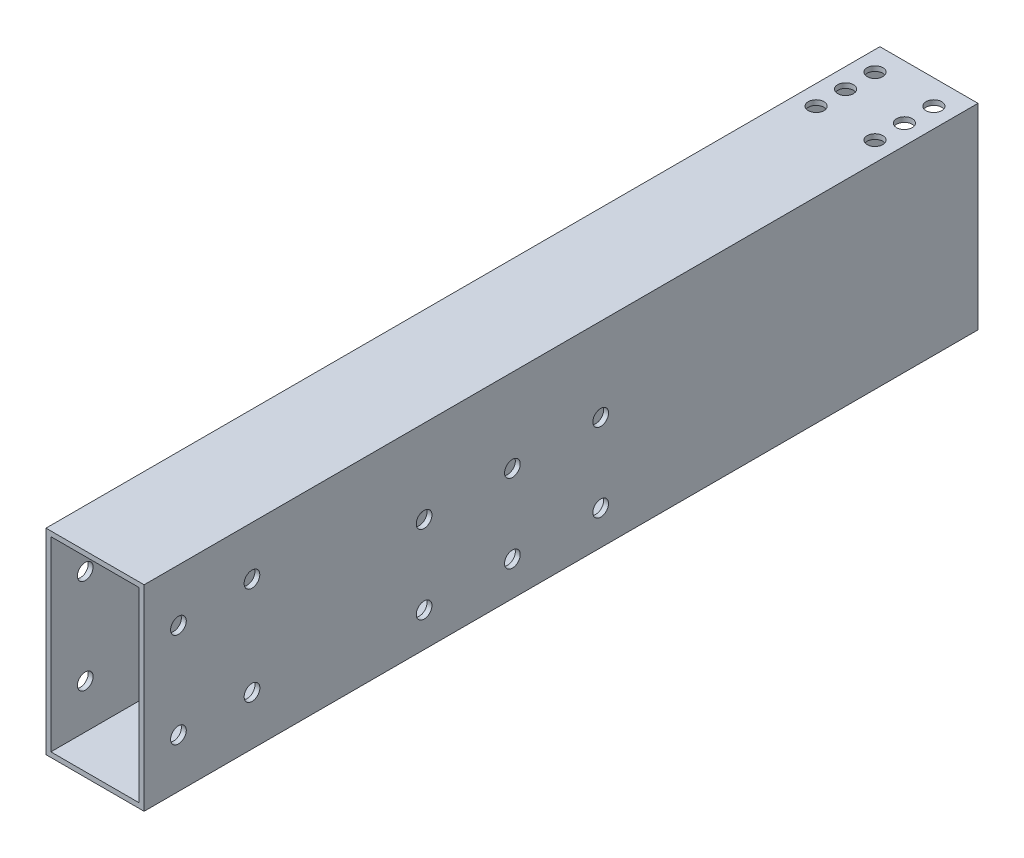
from build123d import *

# Parameters (mm, degrees)
SKETCH_1_W          = 20
SKETCH_1_H          = 40
SKETCH_1_W_2        = 18
SKETCH_1_H_2        = 38
EXTRUDE_1_DEPTH     = 170
SKETCH_12_R         = 1.6
CUT_EXTRUDE_2_DEPTH = 176.783958312
SKETCH_13_R         = 1.6
CUT_EXTRUDE_3_DEPTH = 176.783958312
SKETCH_14_R         = 1.6
CUT_EXTRUDE_4_DEPTH = 176.783958312


with BuildPart() as part:
    # 草图1 → 凸台-拉伸1 (new body)
    with BuildSketch(Plane.XY):
        with Locations((10, 20)):
            Rectangle(SKETCH_1_W, SKETCH_1_H)
        with Locations((10, 20)):
            Rectangle(SKETCH_1_W_2, SKETCH_1_H_2, mode=Mode.SUBTRACT)
    extrude(amount=EXTRUDE_1_DEPTH)

    # 草图12 → 切除-拉伸2 (cut, through all)
    with BuildSketch(Plane.ZY):
        with Locations((112.92, 7)):
            Circle(SKETCH_12_R)
        with Locations((94.92, 7)):
            Circle(SKETCH_12_R)
        with Locations((76.92, 7)):
            Circle(SKETCH_12_R)
        with Locations((94.92, 23)):
            Circle(SKETCH_12_R)
        with Locations((76.92, 23)):
            Circle(SKETCH_12_R)
        with Locations((112.92, 23)):
            Circle(SKETCH_12_R)
    extrude(amount=-CUT_EXTRUDE_2_DEPTH, mode=Mode.SUBTRACT)

    # 草图13 → 切除-拉伸3 (cut, through all)
    with BuildSketch(Plane.ZY):
        with Locations((163, 29.343081894)):
            Circle(SKETCH_13_R)
        with Locations((163, 10)):
            Circle(SKETCH_13_R)
        with Locations((148.01439139, 29.999994822)):
            Circle(SKETCH_13_R)
        with Locations((148, 10)):
            Circle(SKETCH_13_R)
    extrude(amount=-CUT_EXTRUDE_3_DEPTH, mode=Mode.SUBTRACT)

    # 草图14 → 切除-拉伸4 (cut, through all)
    with BuildSketch(Plane(origin=(0, 40, 0), x_dir=(1, 0, 0), z_dir=(0, 1, 0))):
        with Locations(Location((16, -11, 0), (0, 0, 270))):
            Circle(SKETCH_14_R)
        with Locations(Location((4, -11, 0), (0, 0, 270))):
            Circle(SKETCH_14_R)
        with Locations(Location((16, -5, 0), (0, 0, 270))):
            Circle(SKETCH_14_R)
        with Locations(Location((4, -5, 0), (0, 0, 270))):
            Circle(SKETCH_14_R)
        with Locations(Location((16, -17, 0), (0, 0, 270))):
            Circle(SKETCH_14_R)
        with Locations(Location((4, -17, 0), (0, 0, 270))):
            Circle(SKETCH_14_R)
    extrude(amount=-CUT_EXTRUDE_4_DEPTH, mode=Mode.SUBTRACT)


solid = part.part
